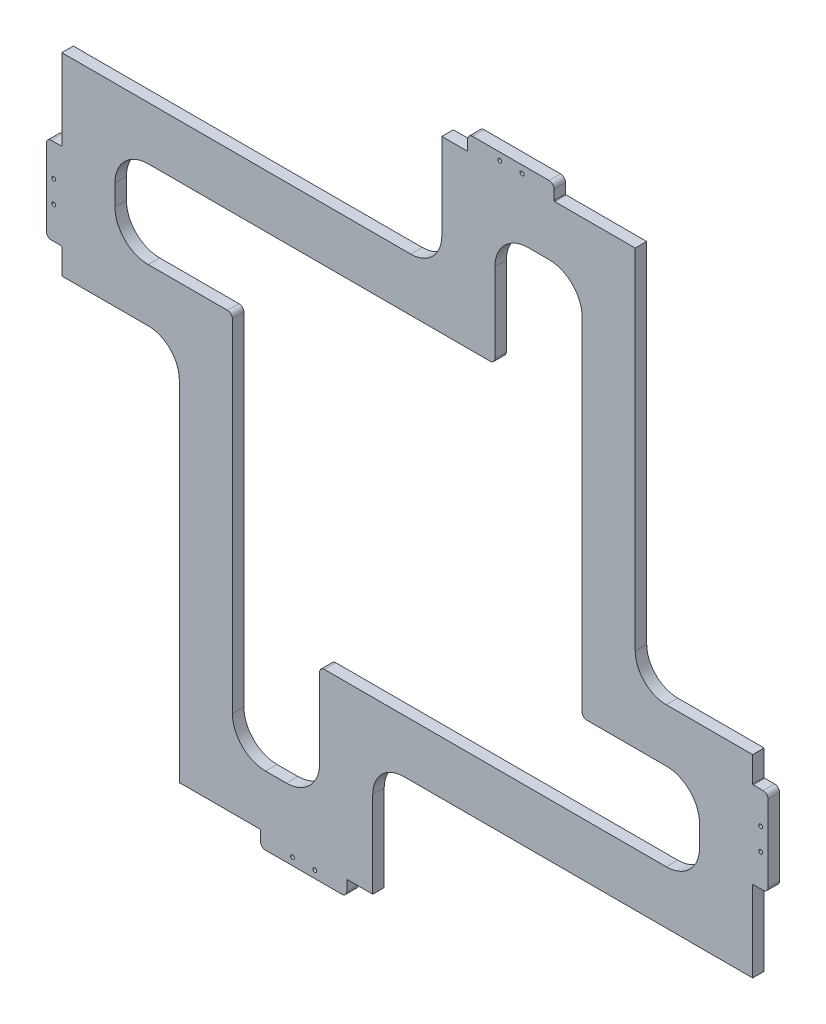
from build123d import *

# Parameters (mm, degrees)
SKETCH2_R          = 0.3937
EXTRUDE1_DEPTH     = 1.1811
CIRPATTERN1_COUNT  = 4
CUT_EXTRUDE1_DEPTH = 2.54


with BuildPart() as part:
    # Sketch2 → Extrude1 (new, symmetric)
    with BuildSketch(Plane.XY):
        with BuildLine():
            Line((-28.40736, 35.5092), (17.044416, 35.5092))
            ThreePointArc((17.044416, 35.5092), (18.048767845, 35.925216155), (18.464784, 36.929568))
            Line((18.464784, 36.929568), (18.464784, 53.2638))
            ThreePointArc((18.464784, 53.2638), (20.336856699, 57.783383301), (24.85644, 59.655456))
            Line((24.85644, 59.655456), (29.117544, 59.655456))
            ThreePointArc((29.117544, 59.655456), (33.637127301, 57.783383301), (35.5092, 53.2638))
            Line((35.5092, 53.2638), (35.5092, 14.20368))
            Line((35.5092, 14.20368), (46.872144, 14.20368))
            Line((46.872144, 14.20368), (46.872144, 71.0184))
            Line((46.872144, 71.0184), (30.30982, 71.0184))
            ThreePointArc((30.30982, 71.0184), (30.220017439, 71.055597439), (30.18282, 71.1454))
            Line((30.18282, 71.1454), (30.18282, 73.1774))
            ThreePointArc((30.18282, 73.1774), (29.88524049, 73.89582049), (29.16682, 74.1934))
            Line((29.16682, 74.1934), (13.44422, 74.1934))
            ThreePointArc((13.44422, 74.1934), (12.72579951, 73.89582049), (12.42822, 73.1774))
            Line((12.42822, 73.1774), (12.42822, 71.1454))
            ThreePointArc((12.42822, 71.1454), (12.391022561, 71.055597439), (12.30122, 71.0184))
            Line((12.30122, 71.0184), (7.10184, 71.0184))
            Line((7.10184, 71.0184), (7.10184, 53.2638))
            ThreePointArc((7.10184, 53.2638), (5.229767301, 48.744216699), (0.710184, 46.872144))
            Line((0.710184, 46.872144), (-28.40736, 46.872144))
            Line((-28.40736, 46.872144), (-28.40736, 35.5092))
        make_face()
        with Locations((19.01952, 72.6694)):
            Circle(SKETCH2_R, mode=Mode.SUBTRACT)
        with Locations((23.59152, 72.6694)):
            Circle(SKETCH2_R, mode=Mode.SUBTRACT)
    extrude1 = extrude(amount=EXTRUDE1_DEPTH, both=True)

    # CirPattern1: Extrude1 ×4 about axis
    cirpattern1_axis = Axis((0, 0, -69.733664692), (0, 0, 1))
    for i in range(1, CIRPATTERN1_COUNT):
        add(extrude1.rotate(cirpattern1_axis, i * 360 / CIRPATTERN1_COUNT))

    # Sketch3 → Cut-Extrude1 (cut)
    with BuildSketch(Plane.XY.offset(1.1811)):
        with BuildLine():
            Line((29.117544, 60.099956), (24.85644, 60.099956))
            ThreePointArc((24.85644, 60.099956), (20.022547735, 58.097692265), (18.020284, 53.2638))
            Line((18.020284, 53.2638), (18.020284, 36.929568))
            ThreePointArc((18.020284, 36.929568), (17.73445888, 36.23952512), (17.044416, 35.9537))
            Line((17.044416, 35.9537), (-53.2638, 35.9537))
            ThreePointArc((-53.2638, 35.9537), (-58.097692265, 33.951436265), (-60.099956, 29.117544))
            Line((-60.099956, 29.117544), (-60.099956, 24.85644))
            ThreePointArc((-60.099956, 24.85644), (-58.097692265, 20.022547735), (-53.2638, 18.020284))
            Line((-53.2638, 18.020284), (-36.929568, 18.020284))
            ThreePointArc((-36.929568, 18.020284), (-36.23952512, 17.73445888), (-35.9537, 17.044416))
            Line((-35.9537, 17.044416), (-35.9537, -53.2638))
            ThreePointArc((-35.9537, -53.2638), (-33.951436265, -58.097692265), (-29.117544, -60.099956))
            Line((-29.117544, -60.099956), (-24.85644, -60.099956))
            ThreePointArc((-24.85644, -60.099956), (-20.022547735, -58.097692265), (-18.020284, -53.2638))
            Line((-18.020284, -53.2638), (-18.020284, -36.929568))
            ThreePointArc((-18.020284, -36.929568), (-17.73445888, -36.23952512), (-17.044416, -35.9537))
            Line((-17.044416, -35.9537), (53.2638, -35.9537))
            ThreePointArc((53.2638, -35.9537), (58.097692265, -33.951436265), (60.099956, -29.117544))
            Line((60.099956, -29.117544), (60.099956, -24.85644))
            ThreePointArc((60.099956, -24.85644), (58.097692265, -20.022547735), (53.2638, -18.020284))
            Line((53.2638, -18.020284), (36.929568, -18.020284))
            ThreePointArc((36.929568, -18.020284), (36.23952512, -17.73445888), (35.9537, -17.044416))
            Line((35.9537, -17.044416), (35.9537, 53.2638))
            ThreePointArc((35.9537, 53.2638), (33.951436265, 58.097692265), (29.117544, 60.099956))
        make_face()
    extrude(amount=-CUT_EXTRUDE1_DEPTH, mode=Mode.SUBTRACT)


solid = part.part
